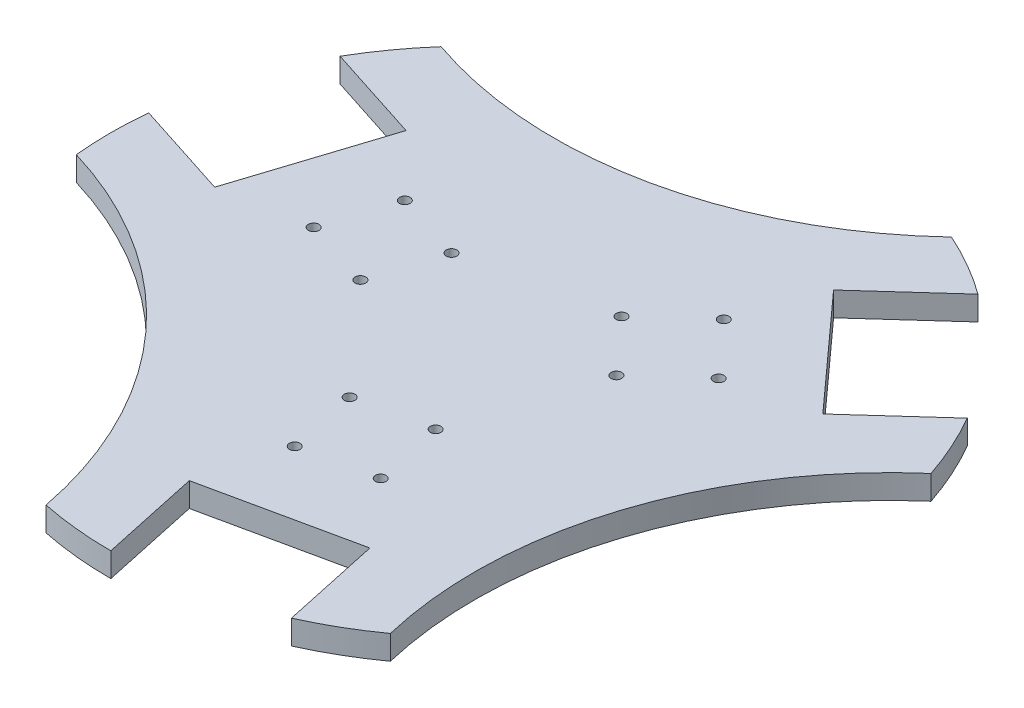
from build123d import *

# Parameters (mm, degrees)
ESQUISSE1_R        = 2.2
BOSS_EXTRU_1_DEPTH = 10


with BuildPart() as part:
    # Esquisse1 → Boss.-Extru.1 (new body)
    with BuildSketch(Plane(origin=(0, 0, 0), x_dir=(1, 0, 0), z_dir=(0, 1, 0))):
        with BuildLine():
            Line((0.042215238, -149.99999406), (-8.86714291, -108.577292103))
            Line((-8.86714291, -108.577292103), (52.724318579, -95.32995759))
            Line((52.724318579, -95.32995759), (61.633676726, -136.752659547))
            ThreePointArc((61.633676726, -136.752659547), (75, -129.903810568), (87.61443884, -121.752659547))
            ThreePointArc((87.61443884, -121.752659547), (91.272869966, -29.412659164), (142.217130056, 47.689494845))
            ThreePointArc((142.217130056, 47.689494845), (136.735308263, 61.672161259), (129.882697804, 75.036556498))
            Line((129.882697804, 75.036556498), (98.46426469, 46.609475032))
            Line((98.46426469, 46.609475032), (56.196005726, 93.325578082))
            Line((56.196005726, 93.325578082), (87.61443884, 121.752659547))
            ThreePointArc((87.61443884, 121.752659547), (75, 129.903810568), (61.633676726, 136.752659547))
            ThreePointArc((61.633676726, 136.752659547), (-20.164324954, 93.750953649), (-112.408879058, 99.318900059))
            ThreePointArc((-112.408879058, 99.318900059), (-121.777312488, 87.58016992), (-129.924913042, 74.963437562))
            Line((-129.924913042, 74.963437562), (-89.59712178, 61.96781707))
            Line((-89.59712178, 61.96781707), (-108.920324304, 2.004379509))
            Line((-108.920324304, 2.004379509), (-149.248115566, 15))
            ThreePointArc((-149.248115566, 15), (-150, 0), (-149.248115566, -15))
            ThreePointArc((-149.248115566, -15), (-71.108545012, -64.338294485), (-29.808250998, -147.008394905))
            ThreePointArc((-29.808250998, -147.008394905), (-14.957995775, -149.252331179), (0.042215238, -149.99999406))
        make_face()
        with Locations(Location((-5.571030795, -45.433447067, 0), (0, 0, 270))):
            Circle(ESQUISSE1_R, mode=Mode.SUBTRACT)
        with Locations(Location((0.663417157, -74.419562014, 0), (0, 0, 270))):
            Circle(ESQUISSE1_R, mode=Mode.SUBTRACT)
        with Locations(Location((29.992684533, -68.111307484, 0), (0, 0, 90))):
            Circle(ESQUISSE1_R, mode=Mode.SUBTRACT)
        with Locations(Location((23.758236581, -39.125192537, 0), (0, 0, 90))):
            Circle(ESQUISSE1_R, mode=Mode.SUBTRACT)
        with Locations(Location((41.871759308, 17.656574754, 0), (0, 0, 270))):
            Circle(ESQUISSE1_R, mode=Mode.SUBTRACT)
        with Locations(Location((64.117522664, 37.784317118, 0), (0, 0, 270))):
            Circle(ESQUISSE1_R, mode=Mode.SUBTRACT)
        with Locations(Location((43.9897803, 60.030080475, 0), (0, 0, 90))):
            Circle(ESQUISSE1_R, mode=Mode.SUBTRACT)
        with Locations(Location((21.744016943, 39.902338111, 0), (0, 0, 90))):
            Circle(ESQUISSE1_R, mode=Mode.SUBTRACT)
        with Locations(Location((-36.226921935, 27.433719884, 0), (0, 0, 270))):
            Circle(ESQUISSE1_R, mode=Mode.SUBTRACT)
        with Locations(Location((-64.780939821, 36.635244896, 0), (0, 0, 270))):
            Circle(ESQUISSE1_R, mode=Mode.SUBTRACT)
        with Locations(Location((-73.982464833, 8.081227009, 0), (0, 0, 90))):
            Circle(ESQUISSE1_R, mode=Mode.SUBTRACT)
        with Locations(Location((-45.428446946, -1.120298002, 0), (0, 0, 90))):
            Circle(ESQUISSE1_R, mode=Mode.SUBTRACT)
    extrude(amount=BOSS_EXTRU_1_DEPTH)


solid = part.part
